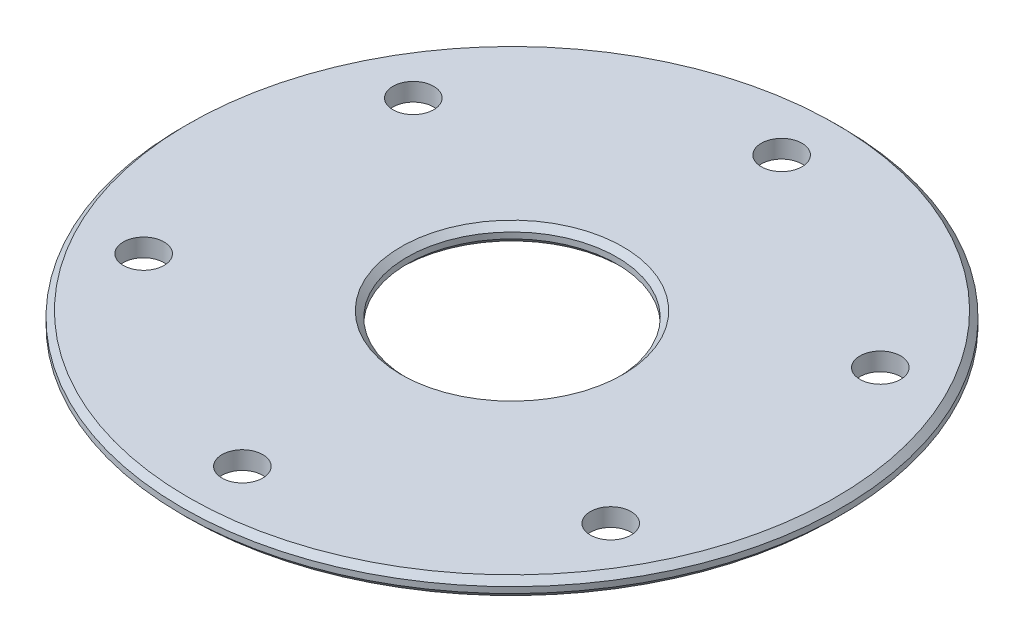
from build123d import *

# Parameters (mm, degrees)
SKETCH_1_R               = 55
EXTRUDE_1_DEPTH          = 3
PATTERN_CIRCULAR_1_COUNT = 6
SKETCH_2_R               = 17.5
CUT_EXTRUDE_1_DEPTH      = 3
CHAMFER_1_SIZE           = 1
CHAMFER_2_SIZE           = 1


with BuildPart() as part:
    # 草图1 → 凸台-拉伸1 (new body)
    with BuildSketch(Plane(origin=(0, 0, 0), x_dir=(1, 0, 0), z_dir=(0, 1, 0))):
        with Locations(Location((0, 0, 0), (0, 0, 270))):
            Circle(SKETCH_1_R)
    extrude(amount=EXTRUDE_1_DEPTH)

    # 草图4 → M8 螺纹孔的螺纹孔钻头1 (revolve, cut)
    with BuildSketch(Plane(origin=(0, 3, -45), x_dir=(0, 0, 1), z_dir=(1, 0, 0))):
        Polygon((0, 0), (0, 18.042926105), (3.4, 16), (3.4, 0), align=None)
    hole_wizard_m8_1 = revolve(axis=Axis((0, 9.35, -45), (0, -1, 0)), mode=Mode.SUBTRACT)

    # 阵列(圆周)1: M8 螺纹孔的螺纹孔钻头1 ×6 about axis
    pattern_circular_1_axis = Axis((0, 0, 0), (0, 1, 0))
    for i in range(1, PATTERN_CIRCULAR_1_COUNT):
        add(hole_wizard_m8_1.rotate(pattern_circular_1_axis, i * 360 / PATTERN_CIRCULAR_1_COUNT), mode=Mode.SUBTRACT)

    # 草图2 → 切除-拉伸1 (cut)
    with BuildSketch(Plane(origin=(0, 3, 0), x_dir=(1, 0, 0), z_dir=(0, 1, 0))):
        with Locations(Location((0, 0, 0), (0, 0, 270))):
            Circle(SKETCH_2_R)
    extrude(amount=-CUT_EXTRUDE_1_DEPTH, mode=Mode.SUBTRACT)

    # 倒角1
    chamfer_1_edges = [part.edges().sort_by_distance(p)[0] for p in [
        (0, 0, -55),
        (0, 3, -55),
    ]]
    chamfer(chamfer_1_edges, length=CHAMFER_1_SIZE)

    # 倒角2
    chamfer_2_edges = [part.edges().sort_by_distance(p)[0] for p in [
        (0, 0, -17.5),
        (0, 3, -17.5),
    ]]
    chamfer(chamfer_2_edges, length=CHAMFER_2_SIZE)


solid = part.part
